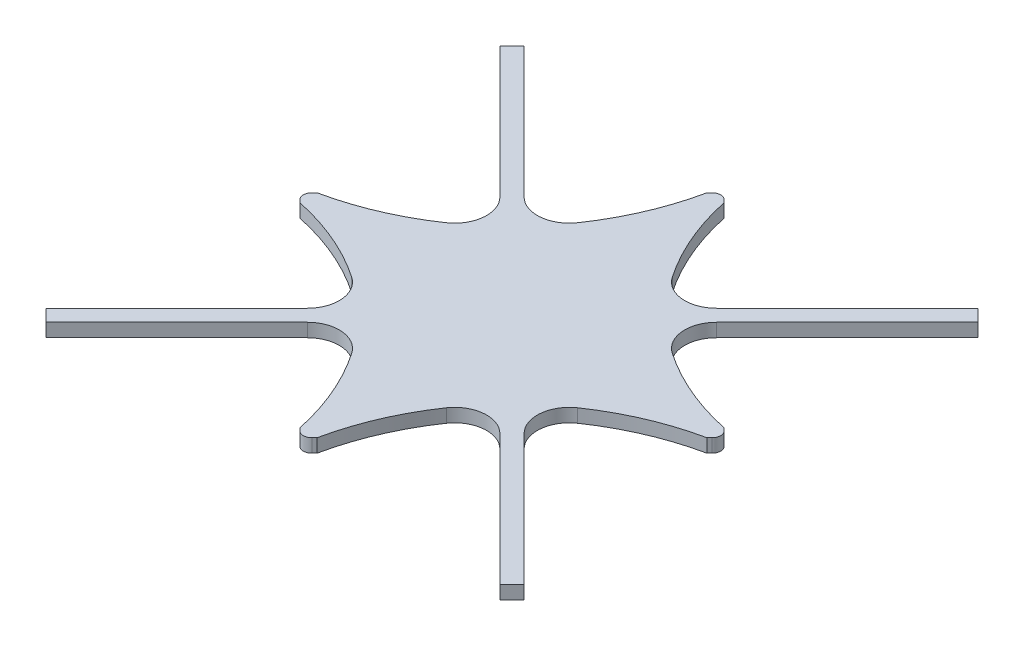
from build123d import *

# Parameters (mm, degrees)
BOSS_EXTRUDE1_DEPTH = 1.6
FILLET1_R           = 1.016
FILLET3_R           = 3.81


with BuildPart() as part:
    # Framesketch → Boss-Extrude1 (new body)
    with BuildSketch(Plane(origin=(0, 0, 0), x_dir=(1, 0, 0), z_dir=(0, 1, 0))):
        with BuildLine():
            Line((-27.040136119, 28.482633953), (-8.475620882, 9.918118716))
            ThreePointArc((-8.475620882, 9.918118716), (-3.768551726, 16.575119627), (-1.023018488, 24.251981512))
            Line((-1.023018488, 24.251981512), (0, 25.275))
            Line((0, 25.275), (1.023018488, 24.251981512))
            ThreePointArc((1.023018488, 24.251981512), (3.768551726, 16.575119627), (8.475620882, 9.918118716))
            Line((8.475620882, 9.918118716), (27.040136119, 28.482633953))
            Line((27.040136119, 28.482633953), (28.482633953, 27.040136119))
            Line((28.482633953, 27.040136119), (9.918118716, 8.475620882))
            ThreePointArc((9.918118716, 8.475620882), (16.575119627, 3.768551726), (24.251981512, 1.023018488))
            Line((24.251981512, 1.023018488), (25.275, 0))
            Line((25.275, 0), (24.251981512, -1.023018488))
            ThreePointArc((24.251981512, -1.023018488), (16.575119627, -3.768551726), (9.918118716, -8.475620882))
            Line((9.918118716, -8.475620882), (28.482633953, -27.040136119))
            Line((28.482633953, -27.040136119), (27.040136119, -28.482633953))
            Line((27.040136119, -28.482633953), (8.475620882, -9.918118716))
            ThreePointArc((8.475620882, -9.918118716), (3.768551726, -16.575119627), (1.023018488, -24.251981512))
            Line((1.023018488, -24.251981512), (0, -25.275))
            Line((0, -25.275), (-1.023018488, -24.251981512))
            ThreePointArc((-1.023018488, -24.251981512), (-3.768551726, -16.575119627), (-8.475620882, -9.918118716))
            Line((-8.475620882, -9.918118716), (-27.040136119, -28.482633953))
            Line((-27.040136119, -28.482633953), (-28.482633953, -27.040136119))
            Line((-28.482633953, -27.040136119), (-9.918118716, -8.475620882))
            ThreePointArc((-9.918118716, -8.475620882), (-16.575119627, -3.768551726), (-24.251981512, -1.023018488))
            Line((-24.251981512, -1.023018488), (-25.275, 0))
            Line((-25.275, 0), (-24.251981512, 1.023018488))
            ThreePointArc((-24.251981512, 1.023018488), (-16.575119627, 3.768551726), (-9.918118716, 8.475620882))
            Line((-9.918118716, 8.475620882), (-28.482633953, 27.040136119))
            Line((-28.482633953, 27.040136119), (-27.040136119, 28.482633953))
        make_face()
    extrude(amount=BOSS_EXTRUDE1_DEPTH)

    # Fillet1
    fillet1_edges = [part.edges().sort_by_distance(p)[0] for p in [
        (-25.275, 0.8, 0),
        (0, 0.8, -25.275),
        (25.275, 0.8, 0),
        (0, 0.8, 25.275),
    ]]
    fillet(fillet1_edges, radius=FILLET1_R)

    # Fillet3
    fillet3_edges = [part.edges().sort_by_distance(p)[0] for p in [
        (-8.475620882, 0.8, 9.918118716),
        (-9.918118716, 0.8, 8.475620882),
        (-9.918118716, 0.8, -8.475620882),
        (-8.475620882, 0.8, -9.918118716),
        (8.475620882, 0.8, -9.918118716),
        (9.918118716, 0.8, -8.475620882),
        (9.918118716, 0.8, 8.475620882),
        (8.475620882, 0.8, 9.918118716),
    ]]
    fillet(fillet3_edges, radius=FILLET3_R)


solid = part.part
